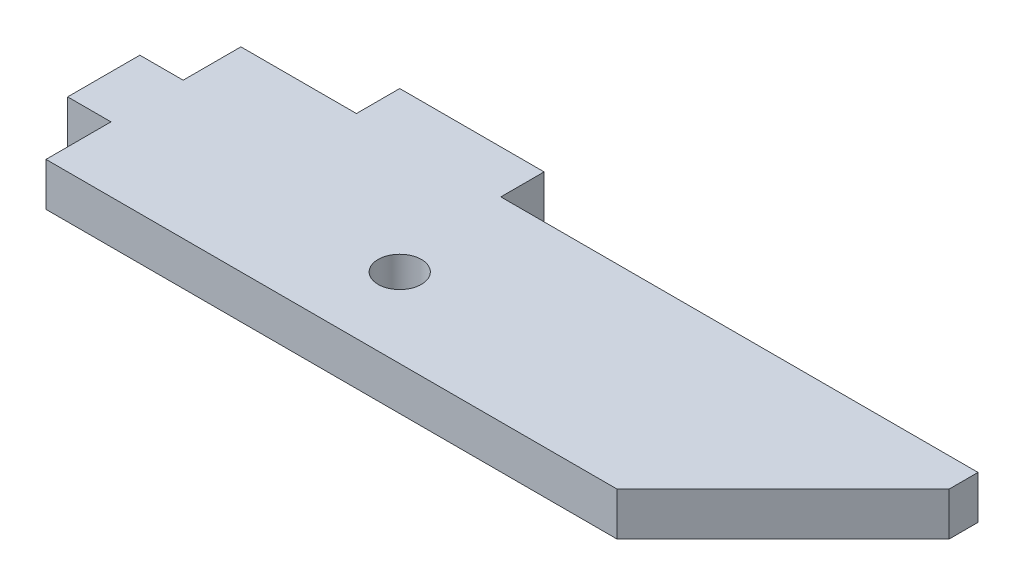
from build123d import *

# Parameters (mm, degrees)
SKETCH1_R           = 1.5
BOSS_EXTRUDE1_DEPTH = 3


with BuildPart() as part:
    # Sketch1 → Boss-Extrude1 (new body)
    with BuildSketch(Plane(origin=(0, 0, 0), x_dir=(1, 0, 0), z_dir=(0, 1, 0))):
        Polygon((-47.380002118, 7.413403038), (-47.380002118, 4.413403038), (-55.380002118, 4.413403038), (-55.380002118, 0.413403038), (-58.380002118, 0.413403038), (-58.380002118, -4.586596962), (-55.380002118, -4.586596962), (-55.380002118, -9.086596962), (-15.820002118, -9.086596962), (-4.330002118, 2.403403038), (-4.330002118, 4.413403038), (-37.380002118, 4.413403038), (-37.380002118, 7.413403038), align=None)
        with Locations(Location((-36.380002118, -3.586596962, 0), (0, 0, 270))):
            Circle(SKETCH1_R, mode=Mode.SUBTRACT)
    extrude(amount=BOSS_EXTRUDE1_DEPTH)


solid = part.part
